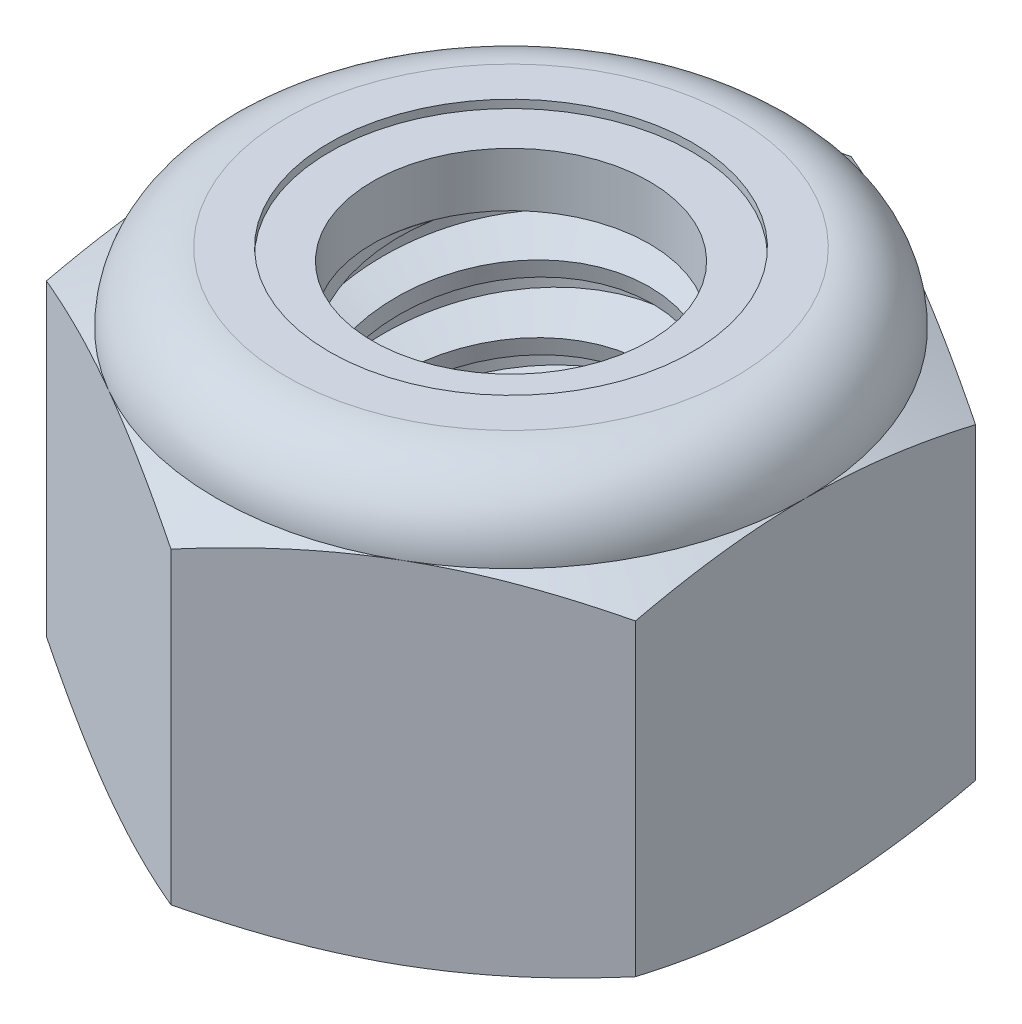
from build123d import *

# Parameters (mm, degrees)
EXTRUDE1_DEPTH      = 7.9375
SKETCH2_W           = 3.175
SKETCH2_H           = 7.9375
LPATTERN1_COUNT     = 6
LPATTERN1_PITCH     = 1.27
LPATTERN1_COL_COUNT = 2
LPATTERN1_COL_PITCH = 1.27


with BuildPart() as part:
    # Sketch1 → Extrude1 (new body)
    with BuildSketch(Plane(origin=(0, 0, 0), x_dir=(1, 0, 0), z_dir=(0, 1, 0))):
        Polygon((0, 6.415804866), (-5.55625, 3.207902433), (-5.55625, -3.207902433), (0, -6.415804866), (5.55625, -3.207902433), (5.55625, 3.207902433), align=None)
    extrude(amount=EXTRUDE1_DEPTH)

    # Sketch4 → Cut-Revolve2 (revolve, cut)
    with BuildSketch(Plane(origin=(0, 0, 0), x_dir=(0, 0, -1), z_dir=(1, 0, 0)), mode=Mode.PRIVATE) as cut_revolve2_sk:
        Polygon((0, 7.9375), (3.175, 7.9375), (2.609908356, 7.673993439), (2.609908356, 0.263506561), (3.175, 0), (0, 0), align=None)
    revolve(cut_revolve2_sk.sketch.rotate(Axis((0, 7.9375, 0), (0, 1, 0)), 54.49881281), axis=Axis((0, 7.9375, 0), (0, 1, 0)), mode=Mode.SUBTRACT)


with BuildPart() as body_2:
    # Sketch2 → Revolve1 (revolve)
    with BuildSketch(Plane(origin=(0, 0, 0), x_dir=(0, 0, -1), z_dir=(1, 0, 0))):
        with Locations((1.5875, 3.96875)):
            Rectangle(SKETCH2_W, SKETCH2_H)
    revolve(axis=Axis((0, -3.175, 0), (0, 1, 0)))

    # Sketch3 → Cut-Revolve1 (revolve, cut)
    with BuildSketch(Plane(origin=(0, 0, 0), x_dir=(0, 0, -1), z_dir=(1, 0, 0)), mode=Mode.PRIVATE) as cut_revolve1_sk:
        Polygon((3.206133436, 7.781832818), (3.424067492, 6.692162542), (2.672175229, 6.946518763), (2.609908356, 7.257853128), align=None)
    cut_revolve1 = revolve(cut_revolve1_sk.sketch.rotate(Axis((0, 7.9375, 0.272704483), (0, -0.9805806756909201, -0.19611613513818463)), 180), axis=Axis((0, 7.9375, 0.272704483), (0, -0.9805806756909201, -0.19611613513818463)), mode=Mode.SUBTRACT)

    # LPattern1: Cut-Revolve1 ×6
    with Locations(*[(0, -i * LPATTERN1_PITCH, 0) for i in range(1, LPATTERN1_COUNT)]):
        add(cut_revolve1, mode=Mode.SUBTRACT)

    # LPattern1 col: Cut-Revolve1 ×2
    with Locations(*[(0, i * LPATTERN1_COL_PITCH, 0) for i in range(1, LPATTERN1_COL_COUNT)]):
        add(cut_revolve1, mode=Mode.SUBTRACT)


with BuildPart() as part_1:
    add(part.part)

    # Combine1: cut body 2
    add(body_2.part, mode=Mode.SUBTRACT)

    # Sketch5 → Cut-Revolve3 (revolve, cut)
    with BuildSketch(Plane(origin=(0, 0, 0), x_dir=(0, 0, -1), z_dir=(1, 0, 0)), mode=Mode.PRIVATE) as cut_revolve3_sk:
        with BuildLine():
            Line((0, 0), (5.55625, 0))
            Line((5.55625, 0), (6.415804866, 0.400817017))
            Line((6.415804866, 0.400817017), (6.415804866, 6.213766317))
            Line((6.415804866, 6.213766317), (5.55625, 6.614583333))
            ThreePointArc((5.55625, 6.614583333), (5.168776679, 7.550026679), (4.233333333, 7.9375))
            Line((4.233333333, 7.9375), (4.233333333, 9.2075))
            Line((4.233333333, 9.2075), (7.685804866, 9.2075))
            Line((7.685804866, 9.2075), (7.685804866, -1.27))
            Line((7.685804866, -1.27), (0, -1.27))
            Line((0, -1.27), (0, 0))
        make_face()
    revolve(cut_revolve3_sk.sketch.rotate(Axis((0, 0, 0), (0, 1, 0)), 54.619043446), axis=Axis((0, 0, 0), (0, 1, 0)), mode=Mode.SUBTRACT)

    # Sketch6 → Cut-Revolve4 (revolve, cut)
    with BuildSketch(Plane(origin=(0, 0, 0), x_dir=(0, 0, -1), z_dir=(1, 0, 0)), mode=Mode.PRIVATE) as cut_revolve4_sk:
        with BuildLine():
            Line((0, 6.614583333), (5.40385, 6.614583333))
            ThreePointArc((5.40385, 6.614583333), (5.061013606, 7.442263606), (4.233333333, 7.7851))
            Line((4.233333333, 7.7851), (3.421620845, 7.7851))
            Line((3.421620845, 7.7851), (3.421620845, 9.2075))
            Line((3.421620845, 9.2075), (0, 9.2075))
            Line((0, 9.2075), (0, 6.614583333))
        make_face()
    revolve(cut_revolve4_sk.sketch.rotate(Axis((0, 9.2075, 0), (0, 1, 0)), 54.49881281), axis=Axis((0, 9.2075, 0), (0, 1, 0)), mode=Mode.SUBTRACT)


with BuildPart() as body_2_2:
    # Sketch7 → Revolve2 (revolve)
    with BuildSketch(Plane(origin=(0, 0, 0), x_dir=(0, 0, -1), z_dir=(1, 0, 0))):
        with BuildLine():
            Line((2.609908356, 6.690783333), (5.324993778, 6.690783333))
            ThreePointArc((5.324993778, 6.690783333), (4.979705237, 7.4148695), (4.233333333, 7.7089))
            Line((4.233333333, 7.7089), (2.609908356, 7.7089))
            Line((2.609908356, 7.7089), (2.609908356, 6.690783333))
        make_face()
    revolve(axis=Axis((0, 6.690783333, 0), (0, 1, 0)))


solid = Compound([part_1.part, body_2_2.part])
